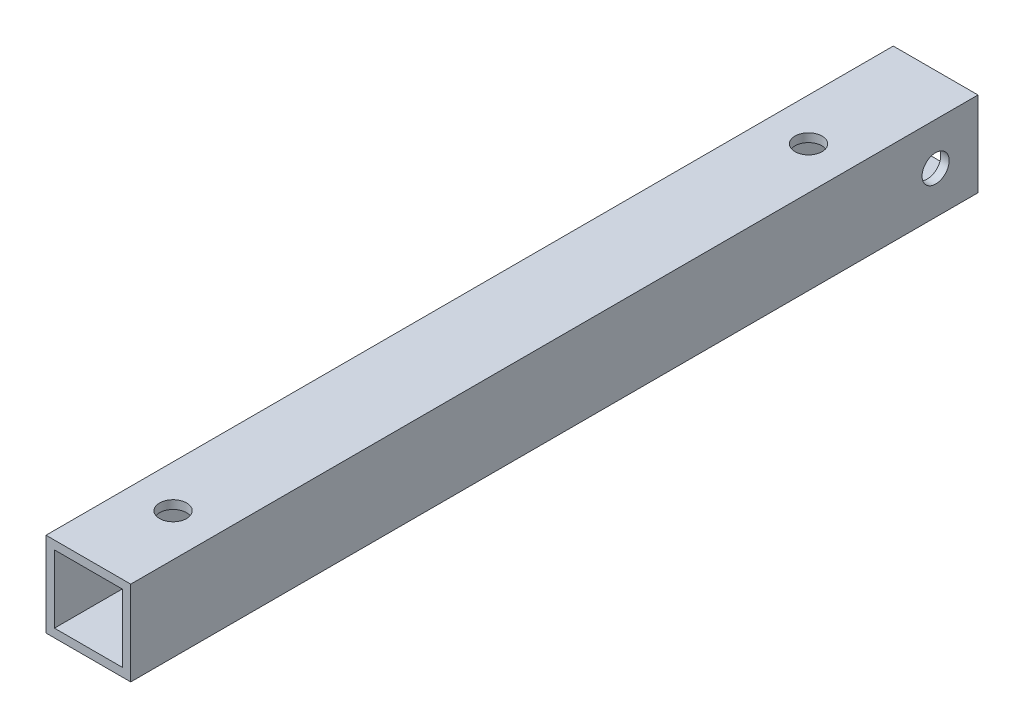
from build123d import *

# Parameters (mm, degrees)
SKETCH_1_W          = 10
SKETCH_1_H          = 10
SKETCH_1_W_2        = 8
SKETCH_1_H_2        = 8
EXTRUDE_1_DEPTH     = 100
SKETCH_2_R          = 1.6
CUT_EXTRUDE_1_DEPTH = 101.623058987
SKETCH_3_R          = 1.6
CUT_EXTRUDE_2_DEPTH = 101.623058987
SKETCH_5_R          = 1.6
CUT_EXTRUDE_4_DEPTH = 101.623058987


with BuildPart() as part:
    # ｽｹｯﾁ1 → ﾎﾞｽ - 押し出し1 (new body)
    with BuildSketch(Plane.XY):
        Rectangle(SKETCH_1_W, SKETCH_1_H)
        Rectangle(SKETCH_1_W_2, SKETCH_1_H_2, mode=Mode.SUBTRACT)
    extrude(amount=EXTRUDE_1_DEPTH)

    # ｽｹｯﾁ2 → ｶｯﾄ - 押し出し1 (cut, through all)
    with BuildSketch(Plane.ZY.offset(5)):
        with Locations(Location((5, 0, 0), (0, 0, 270))):
            Circle(SKETCH_2_R)
    extrude(amount=-CUT_EXTRUDE_1_DEPTH, mode=Mode.SUBTRACT)

    # ｽｹｯﾁ3 → ｶｯﾄ - 押し出し2 (cut, through all)
    with BuildSketch(Plane(origin=(0, 5, 0), x_dir=(1, 0, 0), z_dir=(0, 1, 0))):
        with Locations(Location((0, -90, 0), (0, 0, 270))):
            Circle(SKETCH_3_R)
    extrude(amount=-CUT_EXTRUDE_2_DEPTH, mode=Mode.SUBTRACT)

    # ｽｹｯﾁ5 → ｶｯﾄ - 押し出し4 (cut, through all)
    with BuildSketch(Plane(origin=(0, 5, 0), x_dir=(1, 0, 0), z_dir=(0, 1, 0))):
        with Locations(Location((0, -15, 0), (0, 0, 270))):
            Circle(SKETCH_5_R)
    extrude(amount=-CUT_EXTRUDE_4_DEPTH, mode=Mode.SUBTRACT)


solid = part.part
